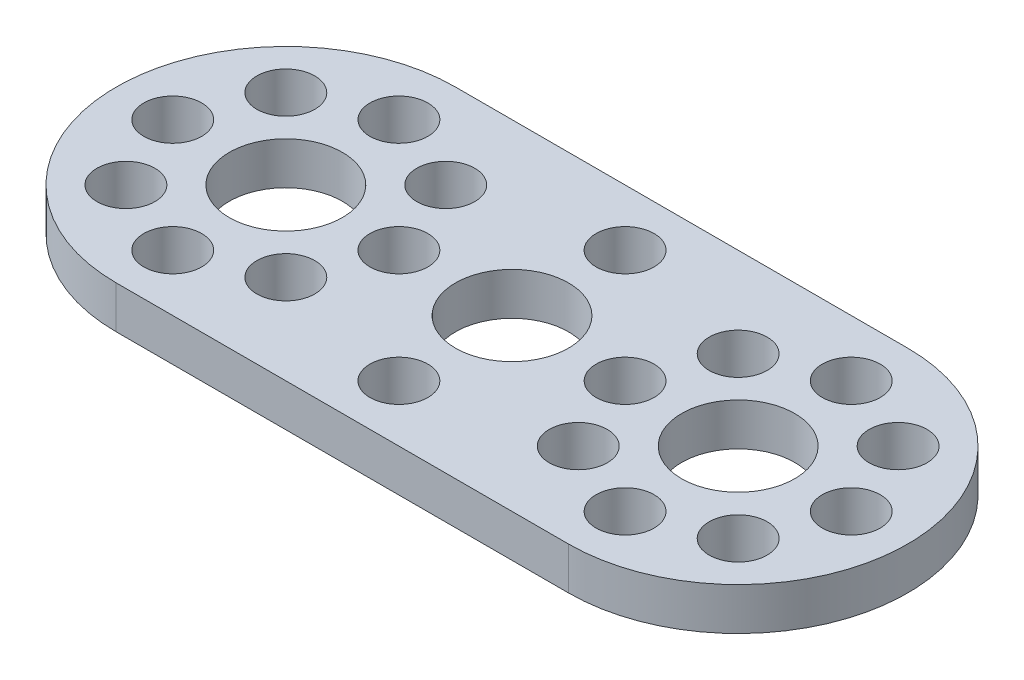
from build123d import *

# Parameters (mm, degrees)
BOSS_EXTRUDE1_DEPTH = 3
SKETCH2_R           = 4
CUT_EXTRUDE1_DEPTH  = 46.705579528
SKETCH3_R           = 2.05
CUT_EXTRUDE2_DEPTH  = 46.705579528


with BuildPart() as part:
    # Sketch1 → Boss-Extrude1 (new body)
    with BuildSketch(Plane(origin=(0, 0, 0), x_dir=(1, 0, 0), z_dir=(0, 1, 0))):
        with BuildLine():
            Line((0, 12), (32, 12))
            ThreePointArc((32, 12), (44, 0), (32, -12))
            Line((32, -12), (0, -12))
            ThreePointArc((0, -12), (-12, 0), (0, 12))
        make_face()
    extrude(amount=BOSS_EXTRUDE1_DEPTH)

    # Sketch2 → Cut-Extrude1 (cut, through all)
    with BuildSketch(Plane(origin=(0, 3, 0), x_dir=(1, 0, 0), z_dir=(0, 1, 0))):
        with Locations(Location((0, 0, 0), (0, 0, 270))):
            Circle(SKETCH2_R)
        with Locations(Location((16, 0, 0), (0, 0, 270))):
            Circle(SKETCH2_R)
        with Locations(Location((32, 0, 0), (0, 0, 270))):
            Circle(SKETCH2_R)
    extrude(amount=-CUT_EXTRUDE1_DEPTH, mode=Mode.SUBTRACT)

    # Sketch3 → Cut-Extrude2 (cut, through all)
    with BuildSketch(Plane(origin=(0, 3, 0), x_dir=(1, 0, 0), z_dir=(0, 1, 0))):
        with Locations(Location((0, 8, 0), (0, 0, 270))):
            Circle(SKETCH3_R)
        with Locations(Location((5.656854249, 5.656854249, 0), (0, 0, 270))):
            Circle(SKETCH3_R)
        with Locations(Location((8, 0, 0), (0, 0, 270))):
            Circle(SKETCH3_R)
        with Locations(Location((5.656854249, -5.656854249, 0), (0, 0, 270))):
            Circle(SKETCH3_R)
        with Locations(Location((0, -8, 0), (0, 0, 270))):
            Circle(SKETCH3_R)
        with Locations(Location((-5.656854249, -5.656854249, 0), (0, 0, 270))):
            Circle(SKETCH3_R)
        with Locations(Location((-8, 0, 0), (0, 0, 270))):
            Circle(SKETCH3_R)
        with Locations(Location((-5.656854249, 5.656854249, 0), (0, 0, 270))):
            Circle(SKETCH3_R)
        with Locations(Location((26.343145751, -5.656854249, 0), (0, 0, 90))):
            Circle(SKETCH3_R)
        with Locations(Location((32, -8, 0), (0, 0, 90))):
            Circle(SKETCH3_R)
        with Locations(Location((37.656854249, -5.656854249, 0), (0, 0, 90))):
            Circle(SKETCH3_R)
        with Locations(Location((40, 0, 0), (0, 0, 90))):
            Circle(SKETCH3_R)
        with Locations(Location((37.656854249, 5.656854249, 0), (0, 0, 90))):
            Circle(SKETCH3_R)
        with Locations(Location((32, 8, 0), (0, 0, 90))):
            Circle(SKETCH3_R)
        with Locations(Location((26.343145751, 5.656854249, 0), (0, 0, 90))):
            Circle(SKETCH3_R)
        with Locations(Location((24, 0, 0), (0, 0, 90))):
            Circle(SKETCH3_R)
        with Locations(Location((16, 8, 0), (0, 0, 270))):
            Circle(SKETCH3_R)
        with Locations(Location((16, -8, 0), (0, 0, 270))):
            Circle(SKETCH3_R)
    extrude(amount=-CUT_EXTRUDE2_DEPTH, mode=Mode.SUBTRACT)


solid = part.part
